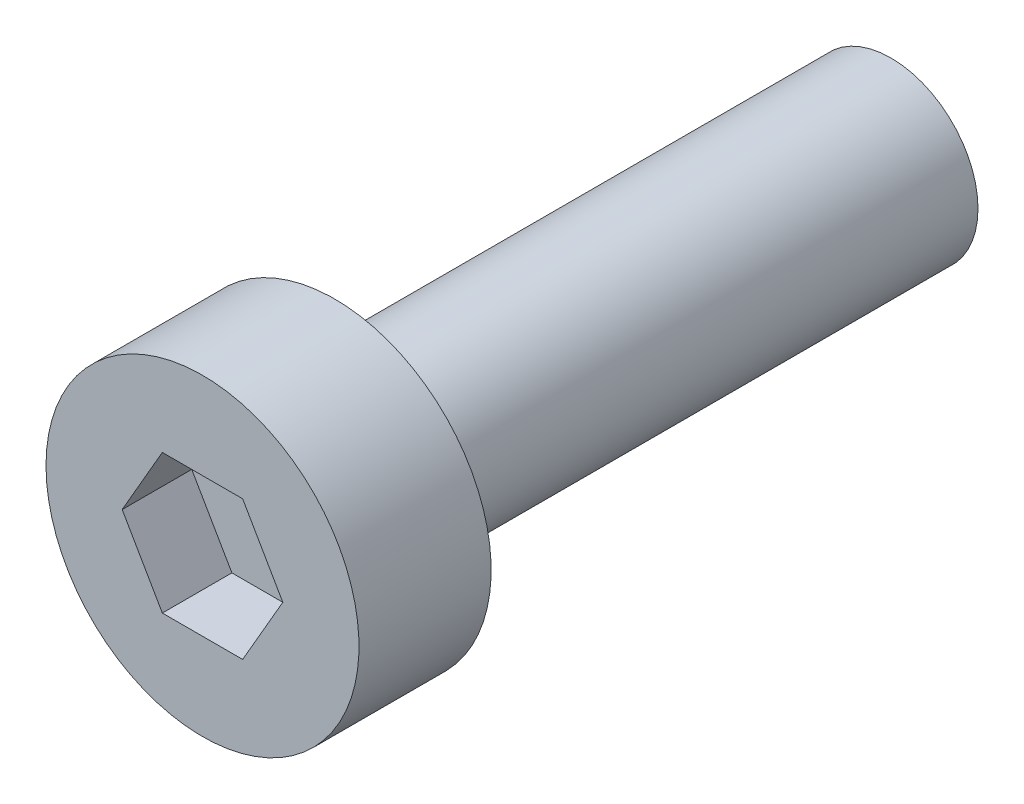
from build123d import *

# Parameters (mm, degrees)
ESQUISSE1_R             = 1.25
BOSS_EXTRU_1_DEPTH      = 8
ESQUISSE2_R             = 2.25
BOSS_EXTRU_2_DEPTH      = 1.9
ENL_V_MAT_EXTRU_1_DEPTH = 1


with BuildPart() as part:
    # Esquisse1 → Boss.-Extru.1 (new body)
    with BuildSketch(Plane.XY):
        Circle(ESQUISSE1_R)
    extrude(amount=BOSS_EXTRU_1_DEPTH)

    # Esquisse2 → Boss.-Extru.2 (add)
    with BuildSketch(Plane.XY.offset(8)):
        with Locations(Location((0, 0, 0), (0, 0, 180))):
            Circle(ESQUISSE2_R)
    extrude(amount=BOSS_EXTRU_2_DEPTH)

    # Esquisse3 → Enlèv. mat.-Extru.1 (cut)
    with BuildSketch(Plane.XY.offset(9.9)):
        Polygon((1.154700538, 0), (0.577350269, 1), (-0.577350269, 1), (-1.154700538, 0), (-0.577350269, -1), (0.577350269, -1), align=None)
    extrude(amount=-ENL_V_MAT_EXTRU_1_DEPTH, mode=Mode.SUBTRACT)


solid = part.part
